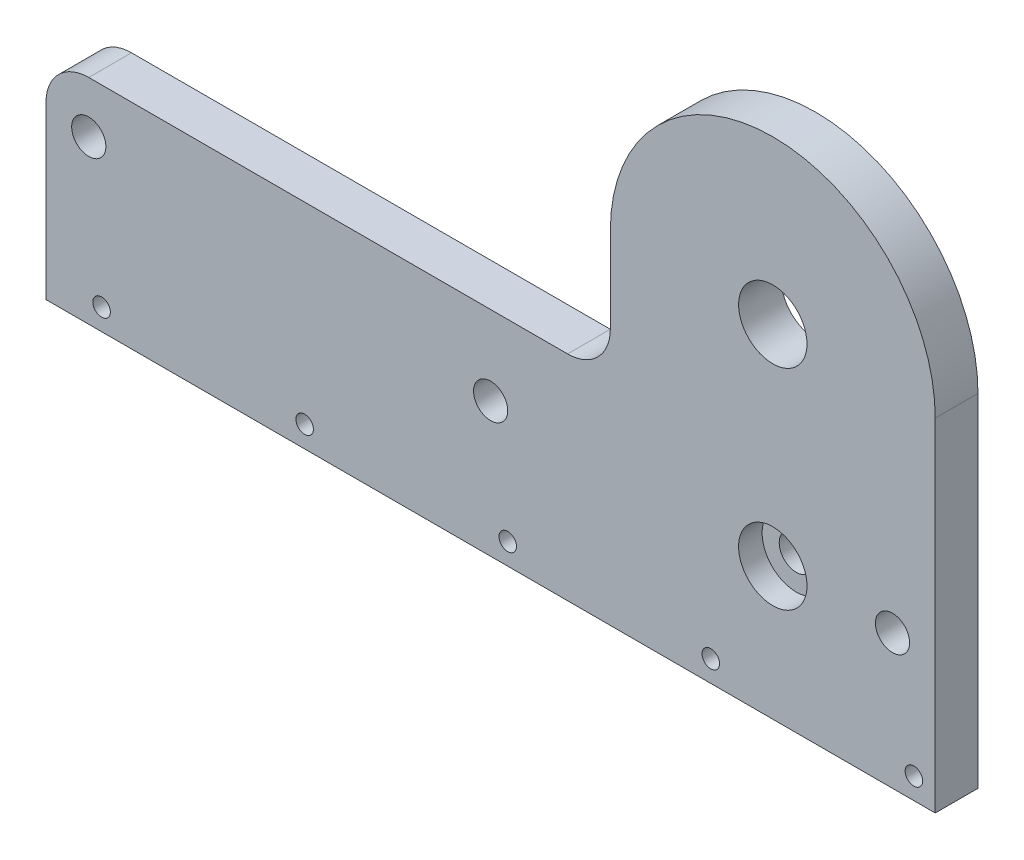
from build123d import *

# Parameters (mm, degrees)
CROQUIS1_R              = 8
SALIENTE_EXTRUIR1_DEPTH = 10
CROQUIS2_R              = 2.05
CORTAR_EXTRUIR1_DEPTH   = 240.3491174
SALIENTE_EXTRUIR2_START = -4.5
CROQUIS3_R              = 8
CROQUIS3_R_2            = 4
SALIENTE_EXTRUIR2_DEPTH = 4.5
CROQUIS4_R              = 4
CORTAR_EXTRUIR2_DEPTH   = 240.3491174


with BuildPart() as part:
    # Croquis1 → Saliente-Extruir1 (new body)
    with BuildSketch(Plane.XY):
        with BuildLine():
            Line((0, 0), (208, 0))
            Line((208, 0), (208, 80))
            ThreePointArc((208, 80), (170, 118), (132, 80))
            Line((132, 80), (132, 60))
            ThreePointArc((132, 60), (129.071067812, 52.928932188), (122, 50))
            Line((122, 50), (10, 50))
            ThreePointArc((10, 50), (2.928932188, 47.071067812), (0, 40))
            Line((0, 40), (0, 0))
        make_face()
        with Locations((170, 80)):
            Circle(CROQUIS1_R, mode=Mode.SUBTRACT)
        with Locations((170, 31)):
            Circle(CROQUIS1_R, mode=Mode.SUBTRACT)
    extrude(amount=-SALIENTE_EXTRUIR1_DEPTH)

    # Croquis2 → Cortar-Extruir1 (cut, through all)
    with BuildSketch(Plane(origin=(0, 0, -10), x_dir=(-1, 0, 0), z_dir=(0, 0, -1))):
        with Locations((-203, 5)):
            Circle(CROQUIS2_R)
        with Locations((-155.5, 5)):
            Circle(CROQUIS2_R)
        with Locations((-108, 5)):
            Circle(CROQUIS2_R)
        with Locations((-60.5, 5)):
            Circle(CROQUIS2_R)
        with Locations((-13, 5)):
            Circle(CROQUIS2_R)
    extrude(amount=-CORTAR_EXTRUIR1_DEPTH, mode=Mode.SUBTRACT)

    # Croquis3 → Saliente-Extruir2 (add)
    with BuildSketch(Plane(origin=(0, 0, -10), x_dir=(-1, 0, 0), z_dir=(0, 0, -1)).offset(SALIENTE_EXTRUIR2_START)):
        with Locations(Location((-170, 31, 0), (0, 0, 180))):
            Circle(CROQUIS3_R)
        with Locations((-170, 31)):
            Circle(CROQUIS3_R_2, mode=Mode.SUBTRACT)
    extrude(amount=SALIENTE_EXTRUIR2_DEPTH)

    # Croquis4 → Cortar-Extruir2 (cut, through all)
    with BuildSketch(Plane.XY):
        with Locations((198, 31.490486181)):
            Circle(CROQUIS4_R)
        with Locations((104, 31.490486181)):
            Circle(CROQUIS4_R)
        with Locations((10, 38)):
            Circle(CROQUIS4_R)
    extrude(amount=-CORTAR_EXTRUIR2_DEPTH, mode=Mode.SUBTRACT)


solid = part.part
